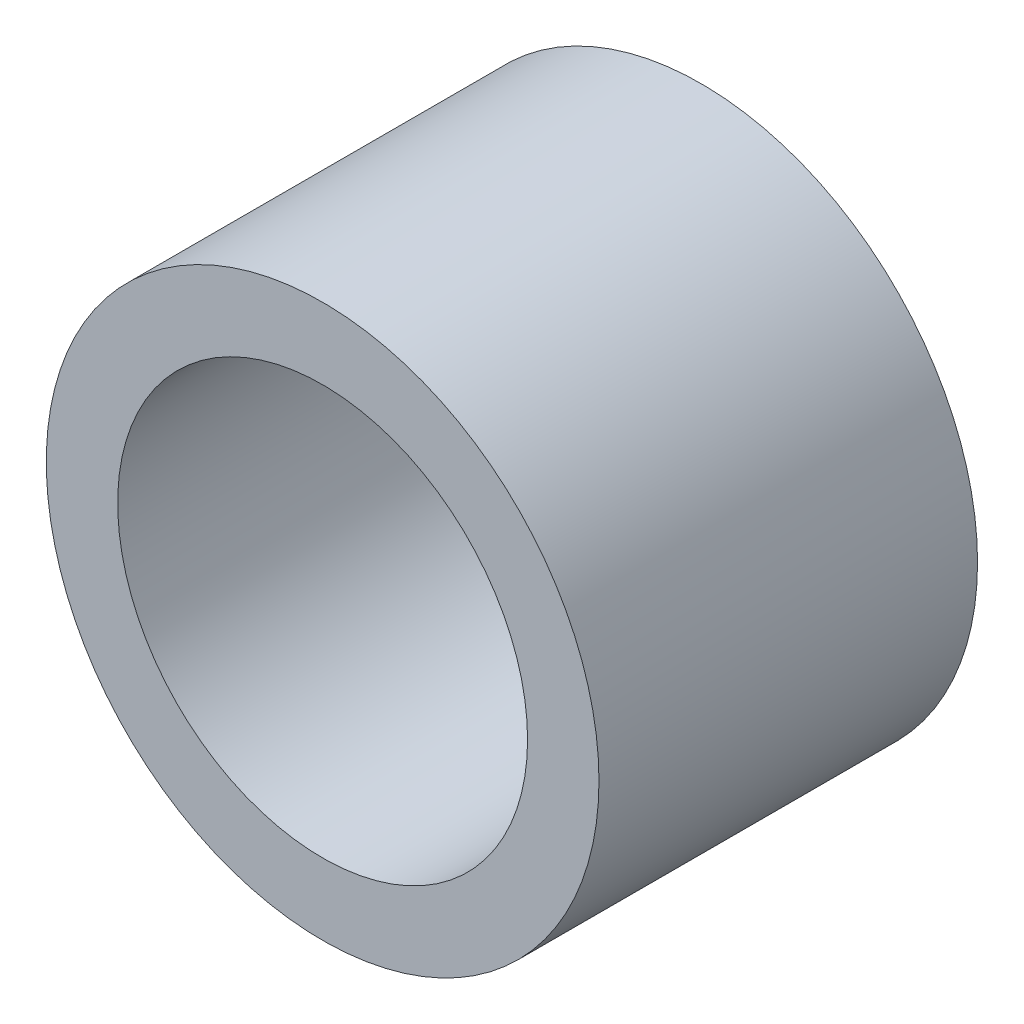
from build123d import *

# Parameters (mm, degrees)
SKETCH1_R           = 9.271
SKETCH1_R_2         = 6.87578
BOSS_EXTRUDE1_DEPTH = 12.7


with BuildPart() as part:
    # Sketch1 → Boss-Extrude1 (new body)
    with BuildSketch(Plane.XY):
        Circle(SKETCH1_R)
        Circle(SKETCH1_R_2, mode=Mode.SUBTRACT)
    extrude(amount=BOSS_EXTRUDE1_DEPTH)


solid = part.part
